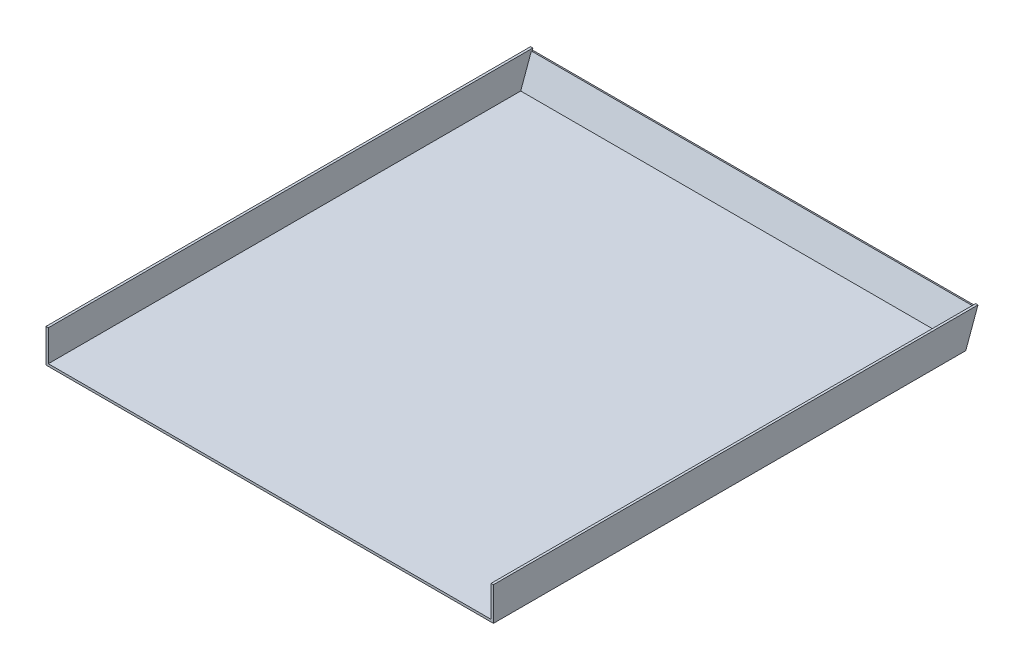
from build123d import *

# Parameters (mm, degrees)
SKETCH1_W                        = 287
SKETCH1_H                        = 303
BOSS_EXTRUDE1_DEPTH              = 1.5
SKETCH8_W                        = 1.5
SKETCH8_H                        = 303
BOSS_EXTRUDE8_DEPTH              = 20
BOSS_EXTRUDE12_DEPTH             = 1.5
BOSS_EXTRUDE13_DEPTH             = 1.5
BOSS_EXTRUDE14_REACH             = 217.497
BOSS_EXTRUDE14_DIRECTION_2_REACH = 217.497


with BuildPart() as part:
    # Sketch1 → Boss-Extrude1 (new body)
    with BuildSketch(Plane(origin=(0, 0, 0), x_dir=(1, 0, 0), z_dir=(0, 1, 0))):
        Rectangle(SKETCH1_W, SKETCH1_H)
    extrude(amount=BOSS_EXTRUDE1_DEPTH)

    # Sketch8 → Boss-Extrude8 (add)
    with BuildSketch(Plane(origin=(0, 1.5, 0), x_dir=(1, 0, 0), z_dir=(0, 1, 0))):
        with Locations((-142.75, 0)):
            Rectangle(SKETCH8_W, SKETCH8_H)
        with Locations((142.75, 0)):
            Rectangle(SKETCH8_W, SKETCH8_H)
    extrude(amount=BOSS_EXTRUDE8_DEPTH)

    # Sketch12 → Boss-Extrude12 (add)
    with BuildSketch(Plane.ZY.offset(143.5)):
        Polygon((-151.5, 21.5), (-159.325360037, 21.5), (-151.5, 0), align=None)
    extrude(amount=-BOSS_EXTRUDE12_DEPTH)

    # Sketch13 → Boss-Extrude13 (add)
    with BuildSketch(Plane(origin=(143.5, 0, 0), x_dir=(0, 0, -1), z_dir=(1, 0, 0))):
        Polygon((151.5, 0), (151.5, 21.5), (159.325360037, 21.5), align=None)
    extrude(amount=-BOSS_EXTRUDE13_DEPTH)

    # Boss-Extrude14: up to this face of the body (flat: up to its plane)
    boss_extrude14_end = Plane(part.part.faces().sort_by_distance((142, 11.538792752, -2.109985057))[0])
    # Sketch15 → Boss-Extrude14 (add, up to the picked face)
    with BuildSketch(Plane(origin=(0, 0, 0), x_dir=(0, 0, -1), z_dir=(1, 0, 0)), mode=Mode.PRIVATE) as boss_extrude14_sk1:
        with BuildLine():
            Line((151.5, 1.5), (158.340402867, 20.293852416))
            Line((158.340402867, 20.293852416), (159.749941798, 19.780822201))
            Line((159.749941798, 19.780822201), (152.909538931, 0.986969785))
            ThreePointArc((152.909538931, 0.986969785), (152.360364655, 0.271271934), (151.5, 0))
            Line((151.5, 0), (151.5, 1.5))
        make_face()
    boss_extrude14_tool1 = split(extrude(boss_extrude14_sk1.sketch, amount=BOSS_EXTRUDE14_REACH, mode=Mode.PRIVATE), bisect_by=boss_extrude14_end, keep=Keep.BOTH, mode=Mode.PRIVATE)
    add(boss_extrude14_tool1.solids().sort_by(Axis((0, 10.206295, -155.467858), (1, 0, 0)))[0])

    # Boss-Extrude14 direction 2: up to this face of the body (flat: up to its plane)
    boss_extrude14_direction_2_end = Plane(part.part.faces().sort_by_distance((-142, 11.538792752, -2.109985057))[0])
    # Sketch15 → Boss-Extrude14 direction 2 (add, up to the picked face)
    with BuildSketch(Plane(origin=(0, 0, 0), x_dir=(0, 0, -1), z_dir=(1, 0, 0)), mode=Mode.PRIVATE) as boss_extrude14_direction_2_sk1:
        with BuildLine():
            Line((151.5, 1.5), (158.340402867, 20.293852416))
            Line((158.340402867, 20.293852416), (159.749941798, 19.780822201))
            Line((159.749941798, 19.780822201), (152.909538931, 0.986969785))
            ThreePointArc((152.909538931, 0.986969785), (152.360364655, 0.271271934), (151.5, 0))
            Line((151.5, 0), (151.5, 1.5))
        make_face()
    boss_extrude14_direction_2_tool1 = split(extrude(boss_extrude14_direction_2_sk1.sketch, amount=-BOSS_EXTRUDE14_DIRECTION_2_REACH, mode=Mode.PRIVATE), bisect_by=boss_extrude14_direction_2_end, keep=Keep.BOTH, mode=Mode.PRIVATE)
    add(boss_extrude14_direction_2_tool1.solids().sort_by(Axis((0, 10.206295, -155.467858), (-1, 0, 0)))[0])


solid = part.part
